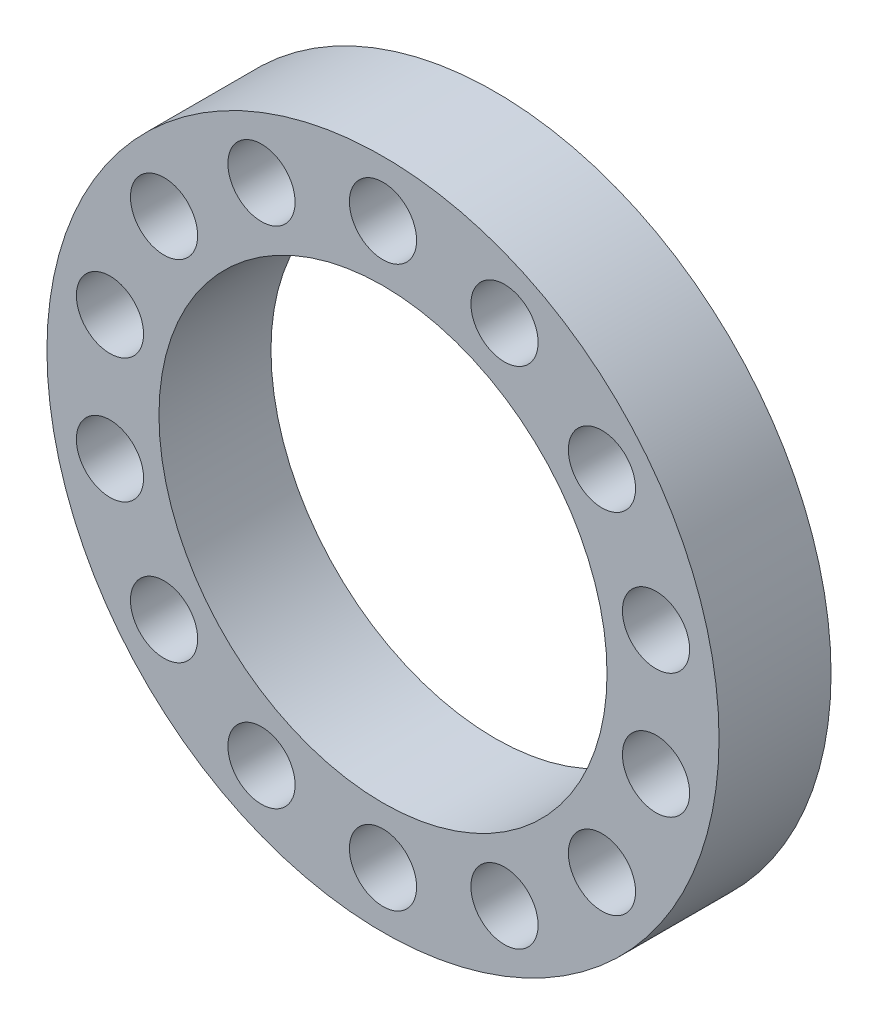
from build123d import *

# Parameters (mm, degrees)
ESQUISSE1_R             = 150
ESQUISSE1_R_2           = 100
BOSS_EXTRU_1_DEPTH      = 50
ESQUISSE2_R             = 15
ENL_V_MAT_EXTRU_1_DEPTH = 40
ESQUISSE3_R             = 6
ENL_V_MAT_EXTRU_2_DEPTH = 10


with BuildPart() as part:
    # Esquisse1 → Boss.-Extru.1 (new body)
    with BuildSketch(Plane.XY):
        Circle(ESQUISSE1_R)
        Circle(ESQUISSE1_R_2, mode=Mode.SUBTRACT)
    extrude(amount=BOSS_EXTRU_1_DEPTH)

    # Esquisse2 → Enlèv. mat.-Extru.1 (cut)
    with BuildSketch(Plane.XY.offset(50)):
        with Locations((0, 125)):
            Circle(ESQUISSE2_R)
        with Locations((54.23546739, 112.621108488)):
            Circle(ESQUISSE2_R)
        with Locations((97.728935309, 77.936225232)):
            Circle(ESQUISSE2_R)
        with Locations((121.865989023, 27.815116745)):
            Circle(ESQUISSE2_R)
        with Locations((121.865989023, -27.815116745)):
            Circle(ESQUISSE2_R)
        with Locations((97.728935309, -77.936225232)):
            Circle(ESQUISSE2_R)
        with Locations((54.23546739, -112.621108488)):
            Circle(ESQUISSE2_R)
        with Locations((0, -125)):
            Circle(ESQUISSE2_R)
        with Locations((-54.23546739, -112.621108488)):
            Circle(ESQUISSE2_R)
        with Locations((-97.728935309, -77.936225232)):
            Circle(ESQUISSE2_R)
        with Locations((-121.865989023, -27.815116745)):
            Circle(ESQUISSE2_R)
        with Locations((-121.865989023, 27.815116745)):
            Circle(ESQUISSE2_R)
        with Locations((-97.728935309, 77.936225232)):
            Circle(ESQUISSE2_R)
        with Locations((-54.23546739, 112.621108488)):
            Circle(ESQUISSE2_R)
    extrude(amount=-ENL_V_MAT_EXTRU_1_DEPTH, mode=Mode.SUBTRACT)

    # Esquisse3 → Enlèv. mat.-Extru.2 (cut)
    with BuildSketch(Plane.XY.offset(10)):
        with Locations((0, 125)):
            Circle(ESQUISSE3_R)
        with Locations((54.23546739, 112.621108488)):
            Circle(ESQUISSE3_R)
        with Locations((97.728935309, 77.936225232)):
            Circle(ESQUISSE3_R)
        with Locations((121.865989023, 27.815116745)):
            Circle(ESQUISSE3_R)
        with Locations((121.865989023, -27.815116745)):
            Circle(ESQUISSE3_R)
        with Locations((97.728935309, -77.936225232)):
            Circle(ESQUISSE3_R)
        with Locations((54.23546739, -112.621108488)):
            Circle(ESQUISSE3_R)
        with Locations((0, -125)):
            Circle(ESQUISSE3_R)
        with Locations((-54.23546739, -112.621108488)):
            Circle(ESQUISSE3_R)
        with Locations((-97.728935309, -77.936225232)):
            Circle(ESQUISSE3_R)
        with Locations((-121.865989023, -27.815116745)):
            Circle(ESQUISSE3_R)
        with Locations((-121.865989023, 27.815116745)):
            Circle(ESQUISSE3_R)
        with Locations((-97.728935309, 77.936225232)):
            Circle(ESQUISSE3_R)
        with Locations((-54.23546739, 112.621108488)):
            Circle(ESQUISSE3_R)
    extrude(amount=-ENL_V_MAT_EXTRU_2_DEPTH, mode=Mode.SUBTRACT)


solid = part.part
